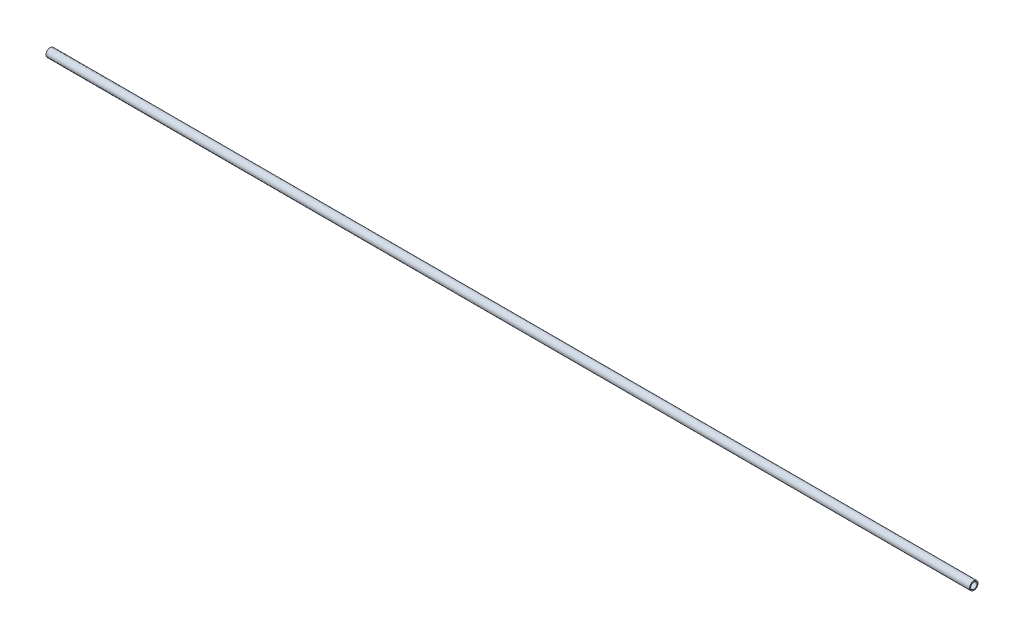
from build123d import *

# Parameters (mm, degrees)
SKETCH1_R           = 12.7
SKETCH1_R_2         = 9.652
BOSS_EXTRUDE1_DEPTH = 2800


with BuildPart() as part:
    # Sketch1 → Boss-Extrude1 (new body)
    with BuildSketch(Plane(origin=(0, 0, 0), x_dir=(0, 0, -1), z_dir=(1, 0, 0))):
        Circle(SKETCH1_R)
        Circle(SKETCH1_R_2, mode=Mode.SUBTRACT)
    extrude(amount=BOSS_EXTRUDE1_DEPTH)


solid = part.part
